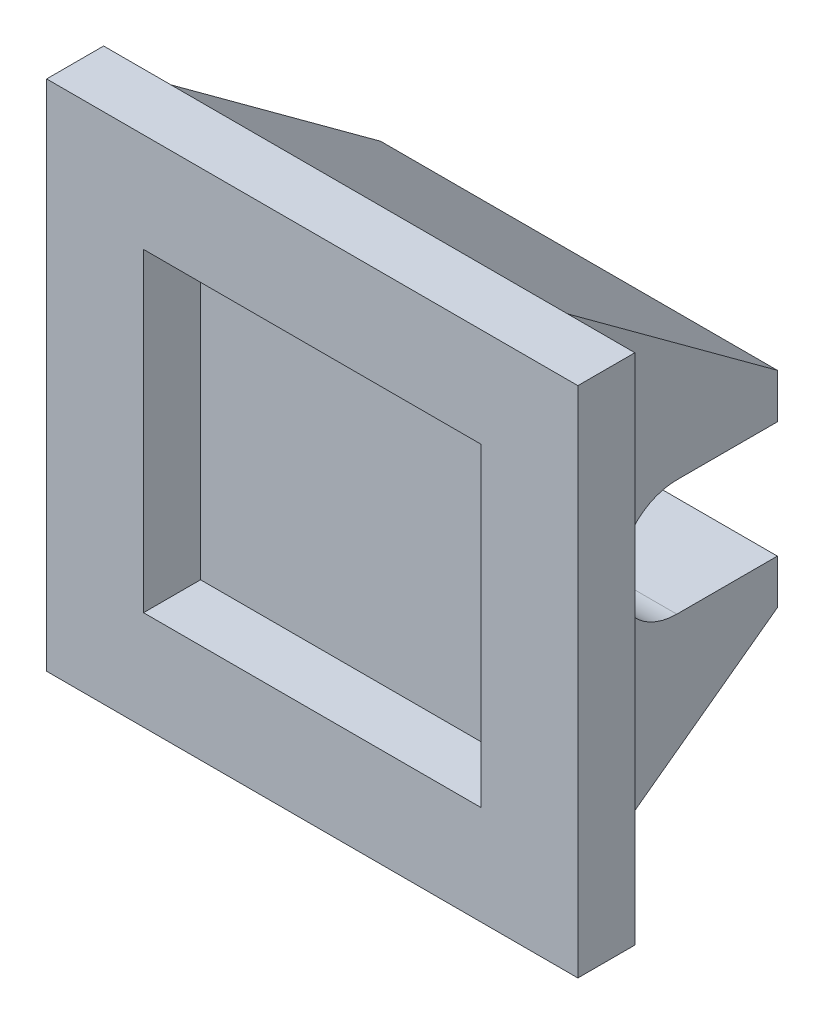
from build123d import *

# Parameters (mm, degrees)
SKETCH1_W           = 29.591
SKETCH1_H           = 28.575
BOSS_EXTRUDE1_DEPTH = 3.175
BOSS_EXTRUDE2_DEPTH = 11.049
SKETCH3_W           = 18.796
SKETCH3_H           = 17.526
CUT_EXTRUDE1_DEPTH  = 3.175


with BuildPart() as part:
    # Sketch1 → Boss-Extrude1 (new body)
    with BuildSketch(Plane.XY):
        Rectangle(SKETCH1_W, SKETCH1_H)
    extrude(amount=BOSS_EXTRUDE1_DEPTH)

    # Sketch2 → Boss-Extrude2 (add, symmetric)
    with BuildSketch(Plane(origin=(0, 0, 0), x_dir=(0, 0, -1), z_dir=(1, 0, 0))):
        with BuildLine():
            Line((0, -14.2875), (11.684, -5.724576677))
            Line((11.684, -5.724576677), (11.684, -3.2385))
            Line((11.684, -3.2385), (6.0833, -3.2385))
            ThreePointArc((6.0833, -3.2385), (2.8448, 0), (6.0833, 3.2385))
            Line((6.0833, 3.2385), (11.684, 3.2385))
            Line((11.684, 3.2385), (11.684, 5.724576677))
            Line((11.684, 5.724576677), (0, 14.2875))
            Line((0, 14.2875), (0, -14.2875))
        make_face()
    extrude(amount=BOSS_EXTRUDE2_DEPTH, both=True)

    # Sketch3 → Cut-Extrude1 (cut)
    with BuildSketch(Plane.XY.offset(3.175)):
        Rectangle(SKETCH3_W, SKETCH3_H)
    extrude(amount=-CUT_EXTRUDE1_DEPTH, mode=Mode.SUBTRACT)


solid = part.part
